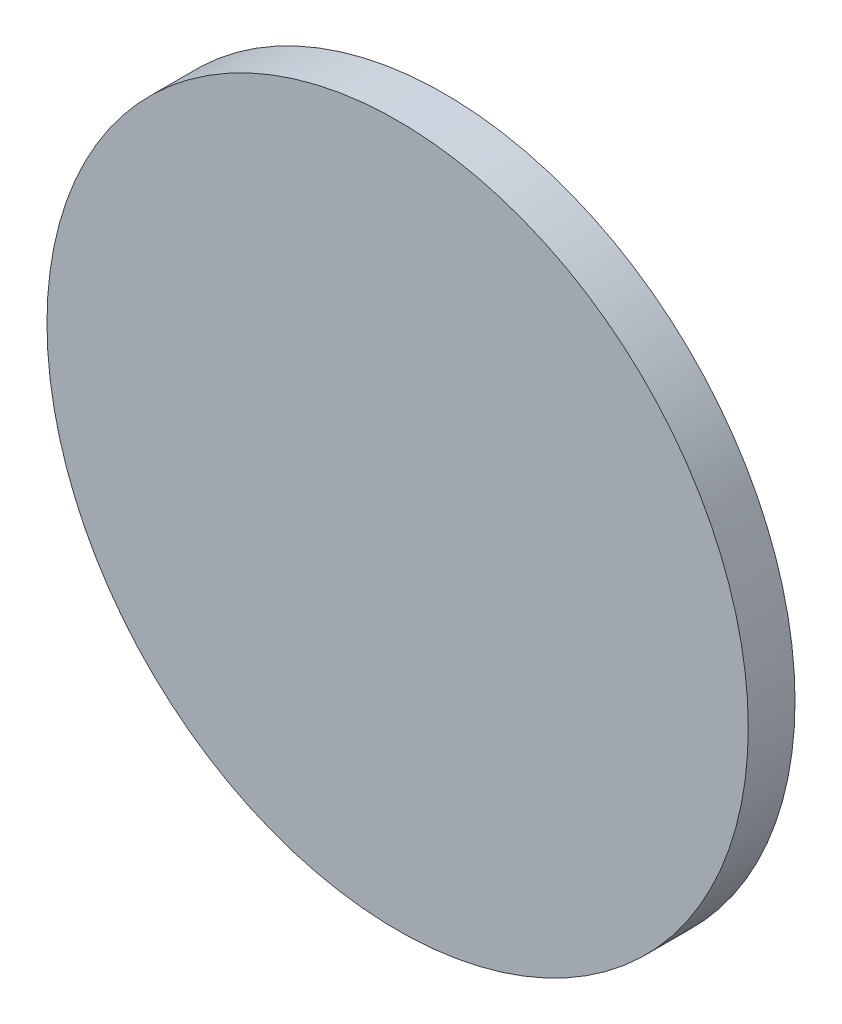
from build123d import *

# Parameters (mm, degrees)
SKETCH1_R           = 75
BOSS_EXTRUDE1_DEPTH = 10


with BuildPart() as part:
    # Sketch1 → Boss-Extrude1 (new body)
    with BuildSketch(Plane.XY):
        Circle(SKETCH1_R)
    extrude(amount=BOSS_EXTRUDE1_DEPTH)


solid = part.part
